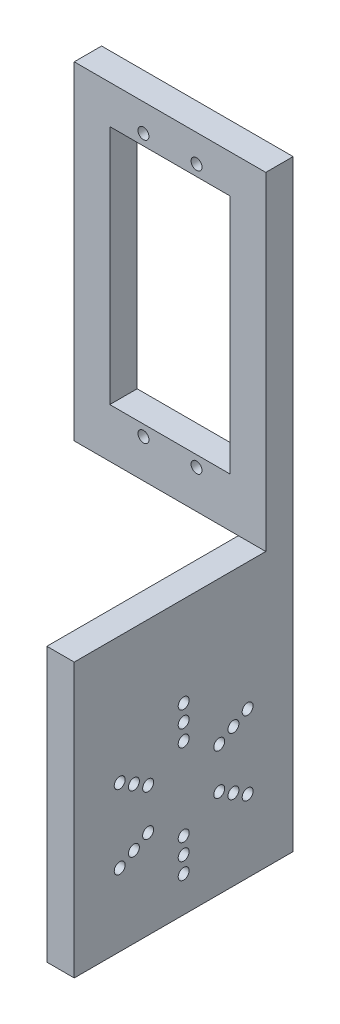
from build123d import *

# Parameters (mm, degrees)
SKETCH1_W           = 35
SKETCH1_H           = 60
SKETCH1_R           = 1
SKETCH1_W_2         = 22
SKETCH1_H_2         = 44
BOSS_EXTRUDE1_DEPTH = 5
SKETCH2_W           = 5
SKETCH2_H           = 50
BOSS_EXTRUDE2_DEPTH = 40
SKETCH3_R           = 1
CUT_EXTRUDE1_DEPTH  = 35


with BuildPart() as part:
    # Sketch1 → Boss-Extrude1 (new body)
    with BuildSketch(Plane.XY):
        with Locations((0, -1)):
            Rectangle(SKETCH1_W, SKETCH1_H)
        with Locations((-4.85, -24)):
            Circle(SKETCH1_R, mode=Mode.SUBTRACT)
        with Locations((4.85, -24)):
            Circle(SKETCH1_R, mode=Mode.SUBTRACT)
        with Locations((4.85, 24)):
            Circle(SKETCH1_R, mode=Mode.SUBTRACT)
        with Locations((-4.85, 24)):
            Circle(SKETCH1_R, mode=Mode.SUBTRACT)
        Rectangle(SKETCH1_W_2, SKETCH1_H_2, mode=Mode.SUBTRACT)
    extrude(amount=BOSS_EXTRUDE1_DEPTH)

    # Sketch2 → Boss-Extrude2 (add)
    with BuildSketch(Plane.XY):
        with Locations((15, -56)):
            Rectangle(SKETCH2_W, SKETCH2_H)
    extrude(amount=BOSS_EXTRUDE2_DEPTH)

    # Sketch3 → Cut-Extrude1 (cut)
    with BuildSketch(Plane(origin=(17.5, 0, 0), x_dir=(0, 0, -1), z_dir=(1, 0, 0))):
        with Locations(Location((-20, -74.5, 0), (0, 0, 90))):
            Circle(SKETCH3_R)
        with Locations(Location((-20, -71.5, 0), (0, 0, 90))):
            Circle(SKETCH3_R)
        with Locations(Location((-20, -68.5, 0), (0, 0, 90))):
            Circle(SKETCH3_R)
        with Locations(Location((-26.495190528, -64.75, 0), (0, 0, 90))):
            Circle(SKETCH3_R)
        with Locations(Location((-29.09326674, -66.25, 0), (0, 0, 90))):
            Circle(SKETCH3_R)
        with Locations(Location((-31.691342951, -67.75, 0), (0, 0, 90))):
            Circle(SKETCH3_R)
        with Locations(Location((-26.495190528, -57.25, 0), (0, 0, 90))):
            Circle(SKETCH3_R)
        with Locations(Location((-29.09326674, -55.75, 0), (0, 0, 90))):
            Circle(SKETCH3_R)
        with Locations(Location((-31.691342951, -54.25, 0), (0, 0, 90))):
            Circle(SKETCH3_R)
        with Locations(Location((-20, -53.5, 0), (0, 0, 90))):
            Circle(SKETCH3_R)
        with Locations(Location((-20, -50.5, 0), (0, 0, 90))):
            Circle(SKETCH3_R)
        with Locations(Location((-20, -47.5, 0), (0, 0, 90))):
            Circle(SKETCH3_R)
        with Locations(Location((-13.504809472, -57.25, 0), (0, 0, 90))):
            Circle(SKETCH3_R)
        with Locations(Location((-10.90673326, -55.75, 0), (0, 0, 90))):
            Circle(SKETCH3_R)
        with Locations(Location((-8.308657049, -54.25, 0), (0, 0, 90))):
            Circle(SKETCH3_R)
        with Locations(Location((-13.504809472, -64.75, 0), (0, 0, 90))):
            Circle(SKETCH3_R)
        with Locations(Location((-10.90673326, -66.25, 0), (0, 0, 90))):
            Circle(SKETCH3_R)
        with Locations(Location((-8.308657049, -67.75, 0), (0, 0, 90))):
            Circle(SKETCH3_R)
    extrude(amount=-CUT_EXTRUDE1_DEPTH, mode=Mode.SUBTRACT)


solid = part.part
